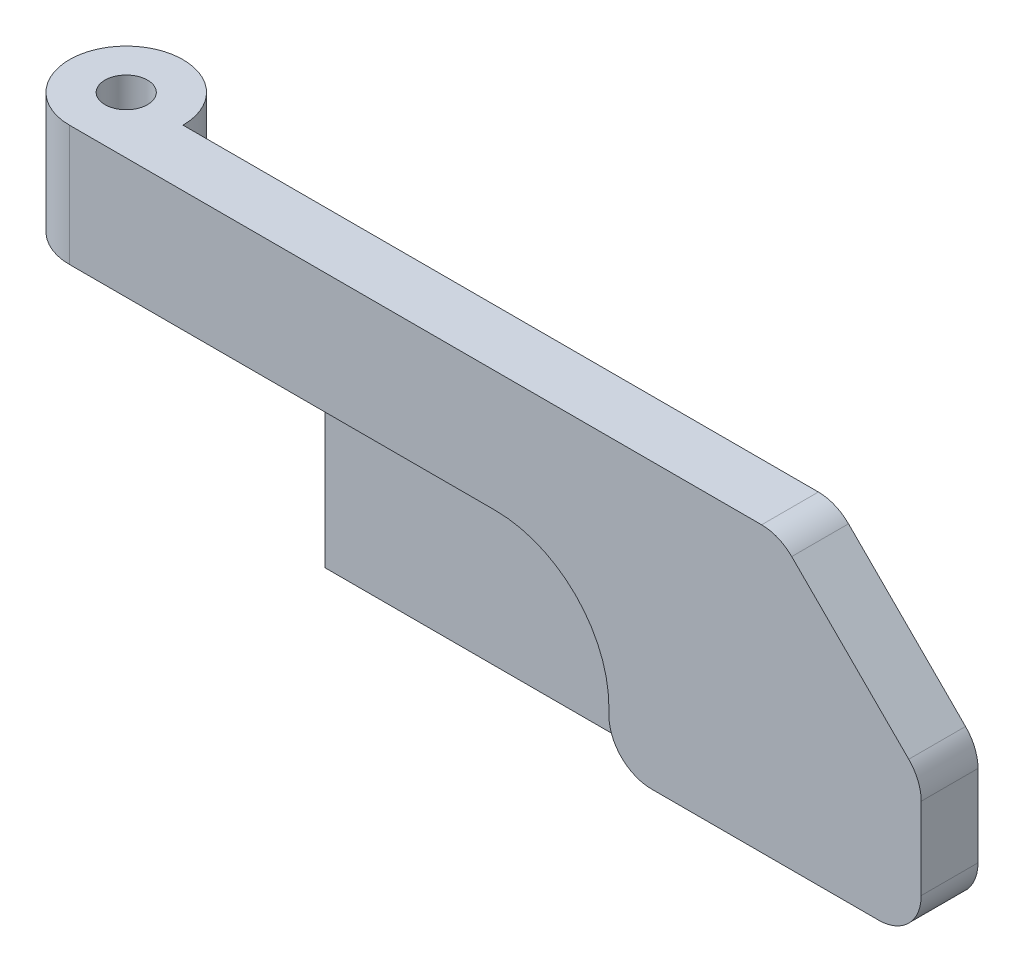
from build123d import *

# Parameters (mm, degrees)
CROQUIS1_R              = 4
CROQUIS1_R_2            = 1.5
SALIENTE_EXTRUIR1_DEPTH = 20
CROQUIS2_W              = 27.807177066
CROQUIS2_H              = 11.5
CORTAR_EXTRUIR1_DEPTH   = 20
CROQUIS3_W              = 22
CROQUIS3_H              = 11.5
CORTAR_EXTRUIR2_DEPTH   = 2
CHAFL_N1_SIZE           = 10
REDONDEO1_R             = 3
REDONDEO2_R             = 3
REDONDEO3_R             = 3
REDONDEO4_R             = 8


with BuildPart() as part:
    # Croquis1 → Saliente-Extruir1 (new body)
    # profile 1 of 2: a face of its own
    with BuildSketch(Plane(origin=(0, 0, 0), x_dir=(1, 0, 0), z_dir=(0, 1, 0))):
        Circle(CROQUIS1_R)
        with Locations(Location((0, 0, 0), (0, 0, 270))):
            Circle(CROQUIS1_R_2, mode=Mode.SUBTRACT)
    # profile 2 of 2: a face of its own
    with BuildSketch(Plane(origin=(0, 0, 0), x_dir=(1, 0, 0), z_dir=(0, 1, 0))):
        with BuildLine():
            Line((60, 0), (4, 0))
            ThreePointArc((4, 0), (2.828427125, -2.828427125), (0, -4))
            Line((0, -4), (60, -4))
            Line((60, -4), (60, 0))
        make_face()
    extrude(amount=SALIENTE_EXTRUIR1_DEPTH)

    # Croquis2 → Cortar-Extruir1 (cut)
    with BuildSketch(Plane.XY.offset(4)):
        with Locations((2.096411467, 5.75)):
            Rectangle(CROQUIS2_W, CROQUIS2_H)
    extrude(amount=-CORTAR_EXTRUIR1_DEPTH, mode=Mode.SUBTRACT)

    # Croquis3 → Cortar-Extruir2 (cut)
    with BuildSketch(Plane.XY.offset(4)):
        with Locations((27, 5.75)):
            Rectangle(CROQUIS3_W, CROQUIS3_H)
    extrude(amount=-CORTAR_EXTRUIR2_DEPTH, mode=Mode.SUBTRACT)

    # Chaflán1
    chafl_n1_edges = [part.edges().sort_by_distance(p)[0] for p in [
        (60, 20, 2),
    ]]
    chamfer(chafl_n1_edges, length=CHAFL_N1_SIZE)

    # Redondeo1
    redondeo1_edges = [part.edges().sort_by_distance(p)[0] for p in [
        (60, 0, 2),
    ]]
    fillet(redondeo1_edges, radius=REDONDEO1_R)

    # Redondeo2
    redondeo2_edges = [part.edges().sort_by_distance(p)[0] for p in [
        (50, 20, 2),
        (60, 10, 2),
    ]]
    fillet(redondeo2_edges, radius=REDONDEO2_R)

    # Redondeo3
    redondeo3_edges = [part.edges().sort_by_distance(p)[0] for p in [
        (38, 0, 3),
    ]]
    fillet(redondeo3_edges, radius=REDONDEO3_R)

    # Redondeo4
    redondeo4_edges = [part.edges().sort_by_distance(p)[0] for p in [
        (38, 11.5, 3),
    ]]
    fillet(redondeo4_edges, radius=REDONDEO4_R)


solid = part.part
